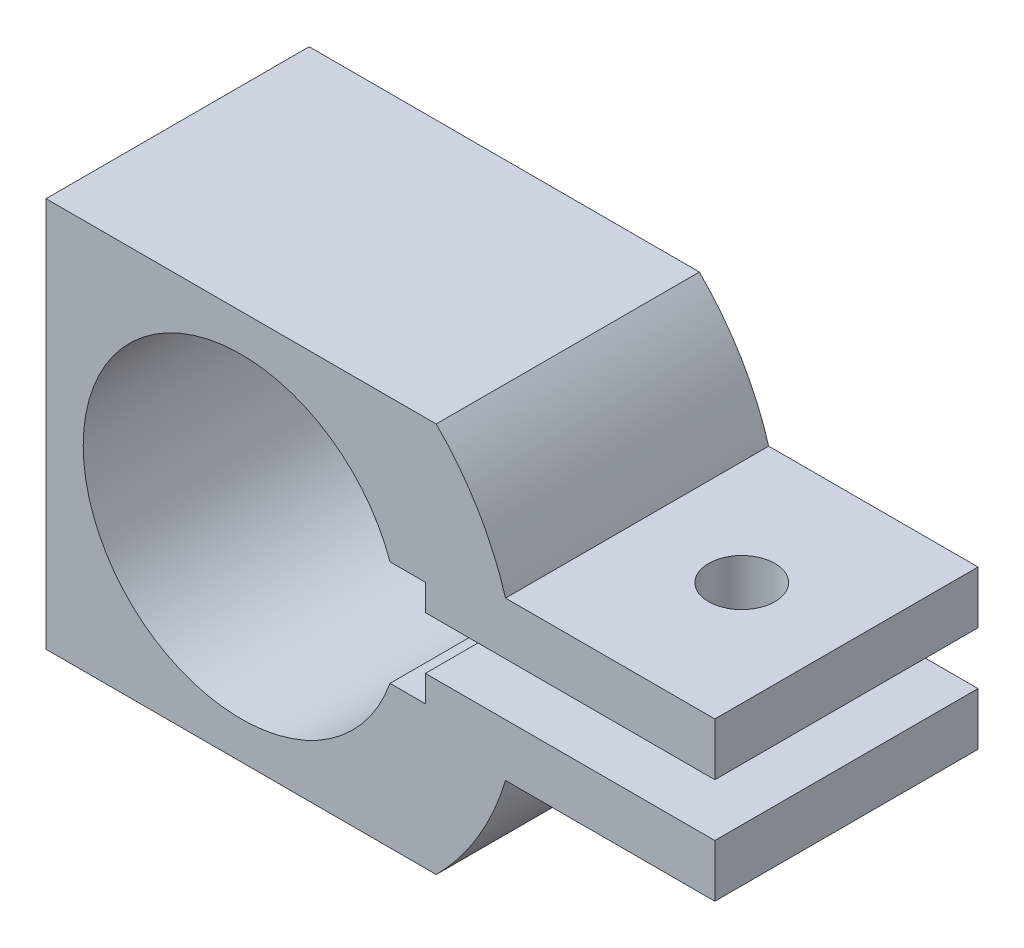
from build123d import *

# Parameters (mm, degrees)
SKETCH_1_W           = 30
SKETCH_1_H           = 14.828427124
EXTRUDE_2_DEPTH      = 10
CUT_EXTRUDE_9_DEPTH  = 15
CUT_EXTRUDE_10_DEPTH = 30
CUT_EXTRUDE_11_DEPTH = 31
CUT_EXTRUDE_12_DEPTH = 40
CUT_EXTRUDE_13_DEPTH = 17
CUT_EXTRUDE_17_DEPTH = 97
CUT_EXTRUDE_18_DEPTH = 285
CUT_EXTRUDE_20_DEPTH = 202
SKETCH_2_R           = 1.26
CUT_EXTRUDE_21_DEPTH = 202
SKETCH_1_23_W        = 11
SKETCH_1_23_H        = 2
CUT_EXTRUDE_22_DEPTH = 95


with BuildPart() as part:
    # 草图1 → 凸台-拉伸2 (new body)
    with BuildSketch(Plane.XY):
        with Locations((7.585786438, 0)):
            Rectangle(SKETCH_1_W, SKETCH_1_H)
    extrude(amount=EXTRUDE_2_DEPTH)

    # 草图1<11> → 切除-拉伸9 (cut)
    with BuildSketch(Plane.XY):
        with BuildLine():
            Line((0, -2), (0, 0))
            Line((0, 0), (-6, 0))
            ThreePointArc((-6, 0), (-4.242640687, -4.242640687), (0, -6))
            ThreePointArc((0, -6), (3.464101615, -4.898979486), (5.656854249, -2))
            Line((5.656854249, -2), (0, -2))
        make_face()
    extrude(amount=CUT_EXTRUDE_9_DEPTH, mode=Mode.SUBTRACT)

    # 草图1<12> → 切除-拉伸10 (cut)
    with BuildSketch(Plane.XY):
        with BuildLine():
            Line((-6, 0), (0, 0))
            Line((0, 0), (0, 2))
            Line((0, 2), (0, 6))
            ThreePointArc((0, 6), (-4.242640687, 4.242640687), (-6, 0))
        make_face()
    extrude(amount=CUT_EXTRUDE_10_DEPTH, mode=Mode.SUBTRACT)

    # 草图1<13> → 切除-拉伸11 (cut)
    with BuildSketch(Plane.XY):
        with BuildLine():
            Line((0, 2), (0, 0))
            Line((0, 0), (6, 0))
            ThreePointArc((6, 0), (5.913591358, 1.014611872), (5.656854249, 2))
            Line((5.656854249, 2), (0, 2))
        make_face()
    extrude(amount=CUT_EXTRUDE_11_DEPTH, mode=Mode.SUBTRACT)

    # 草图1<14> → 切除-拉伸12 (cut)
    with BuildSketch(Plane.XY):
        with BuildLine():
            Line((6, 0), (0, 0))
            Line((0, 0), (0, -2))
            Line((0, -2), (5.656854249, -2))
            ThreePointArc((5.656854249, -2), (5.913591358, -1.014611872), (6, 0))
        make_face()
    extrude(amount=CUT_EXTRUDE_12_DEPTH, mode=Mode.SUBTRACT)

    # 草图1<15> → 切除-拉伸13 (cut)
    with BuildSketch(Plane.XY):
        with BuildLine():
            Line((0, 6), (0, 2))
            Line((0, 2), (5.656854249, 2))
            ThreePointArc((5.656854249, 2), (3.464101615, 4.898979486), (0, 6))
        make_face()
    extrude(amount=CUT_EXTRUDE_13_DEPTH, mode=Mode.SUBTRACT)

    # 草图1<19> → 切除-拉伸17 (cut)
    with BuildSketch(Plane.XY):
        with BuildLine():
            Line((7, 2), (5.656854249, 2))
            ThreePointArc((5.656854249, 2), (6, 0), (5.656854249, -2))
            Line((5.656854249, -2), (7, -2))
            Line((7, -2), (7, 2))
        make_face()
    extrude(amount=CUT_EXTRUDE_17_DEPTH, mode=Mode.SUBTRACT)

    # 草图1<20> → 切除-拉伸18 (cut)
    with BuildSketch(Plane.XY):
        with BuildLine():
            ThreePointArc((7.414213562, 7.414213562), (9.005239827, 5.370919954), (10.046946078, 3))
            Line((10.046946078, 3), (18, 3))
            Line((18, 3), (18, 2))
            Line((18, 2), (18, 1))
            Line((18, 1), (18, -1))
            Line((18, -1), (18, -2))
            Line((18, -2), (18, -3))
            Line((18, -3), (10.046946078, -3))
            ThreePointArc((10.046946078, -3), (9.005239827, -5.370919954), (7.414213562, -7.414213562))
            Line((7.414213562, -7.414213562), (22.585786438, -7.414213562))
            Line((22.585786438, -7.414213562), (22.585786438, 7.414213562))
            Line((22.585786438, 7.414213562), (7.414213562, 7.414213562))
        make_face()
    extrude(amount=CUT_EXTRUDE_18_DEPTH, mode=Mode.SUBTRACT)

    # 草图1<22> → 切除-拉伸20 (cut)
    with BuildSketch(Plane.XY):
        with BuildLine():
            ThreePointArc((10.485281374, 0), (10.473325852, -0.500570761), (10.437486551, -1))
            Line((10.437486551, -1), (18, -1))
            Line((18, -1), (18, 1))
            Line((18, 1), (10.437486551, 1))
            ThreePointArc((10.437486551, 1), (10.473325852, 0.500570761), (10.485281374, 0))
        make_face()
    extrude(amount=CUT_EXTRUDE_20_DEPTH, mode=Mode.SUBTRACT)

    # 草图2 → 切除-拉伸21 (cut)
    with BuildSketch(Plane.XZ.offset(3)):
        with Locations((14.023473039, 5)):
            Circle(SKETCH_2_R)
    extrude(amount=-CUT_EXTRUDE_21_DEPTH, mode=Mode.SUBTRACT)

    # 草图1<23> → 切除-拉伸22 (cut)
    with BuildSketch(Plane.XY):
        with Locations((12.5, 0)):
            Rectangle(SKETCH_1_23_W, SKETCH_1_23_H)
    extrude(amount=CUT_EXTRUDE_22_DEPTH, mode=Mode.SUBTRACT)


solid = part.part
